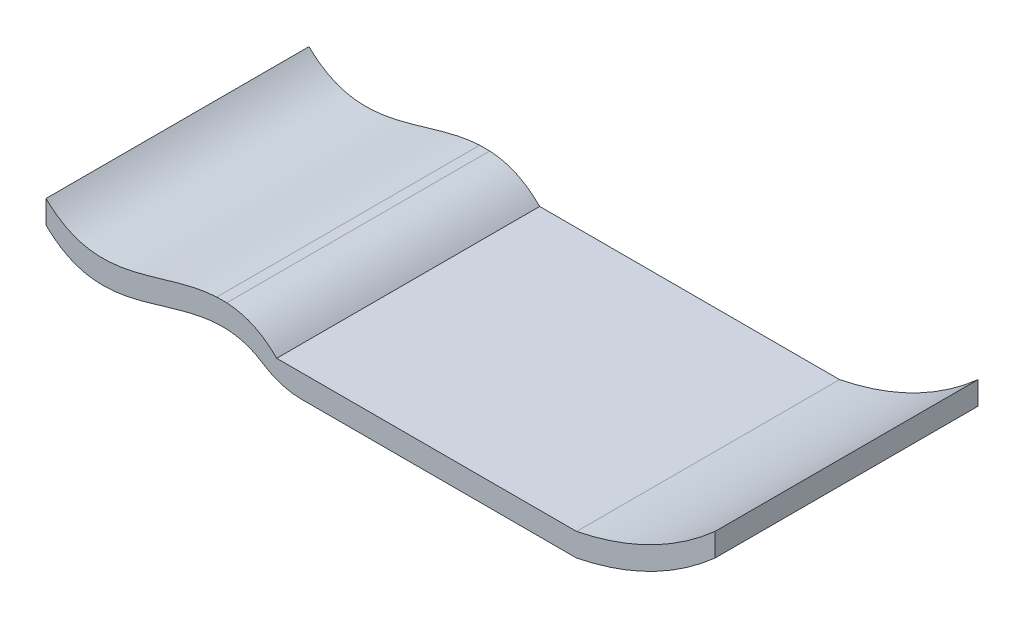
from build123d import *

# Parameters (mm, degrees)
BOSS_EXTRUDE1_DEPTH = 57
FILLET1_R           = 15


with BuildPart() as part:
    # Sketch1 → Boss-Extrude1 (new body)
    with BuildSketch(Plane.XY):
        with BuildLine():
            Line((65, 0), (0, 0))
            add(Edge.make_bspline(
                [(0, 0), (-3.420787062, 3.445195102), (-7.060889651, 4.793606126), (-10.827974412, 5)],
                knots=[0, 0, 0, 0, 0.227402819, 0.227402819, 0.227402819, 0.227402819], degree=3))
            Line((-10.827974412, 5), (-12.998410552, 5))
            add(Edge.make_bspline(
                [(-12.998410552, 5), (-25.222609251, 4.375360382), (-38.571253465, -6.117915944), (-50, 5)],
                knots=[0.270809768, 0.270809768, 0.270809768, 0.270809768, 1, 1, 1, 1], degree=3))
            Line((-50, 5), (-50, 0))
            add(Edge.make_bspline(
                [(0, -5), (-14.762430124, 10.348316204), (-34.295343775, -15.48284378), (-50, 0)],
                knots=[0, 0, 0, 0, 1, 1, 1, 1], degree=3))
            Line((0, -5), (65, -5))
            Line((65, -5), (65, 0))
        make_face()
        with BuildLine():
            Line((80, 0), (65, 0))
            Line((65, 0), (65, -5))
            add(Edge.make_bspline(
                [(65, -5), (72.93083611, -3.380904469), (80, 0)],
                knots=[0, 0, 0, 0.467251417, 0.467251417, 0.467251417], degree=2))
        make_face()
        with BuildLine():
            add(Edge.make_bspline(
                [(65, 0), (81.973380543, 3.465148466), (95, 15)],
                knots=[0, 0, 0, 1, 1, 1], degree=2))
            Line((65, 0), (80, 0))
            add(Edge.make_bspline(
                [(80, 0), (88.060086943, 3.85482419), (95, 10)],
                knots=[0.467251417, 0.467251417, 0.467251417, 1, 1, 1], degree=2))
            Line((95, 10), (95, 15))
        make_face()
    extrude(amount=BOSS_EXTRUDE1_DEPTH)

    # Fillet1
    fillet1_edges = [part.edges().sort_by_distance(p)[0] for p in [
        (0, -5, 28.5),
    ]]
    fillet(fillet1_edges, radius=FILLET1_R)


solid = part.part
